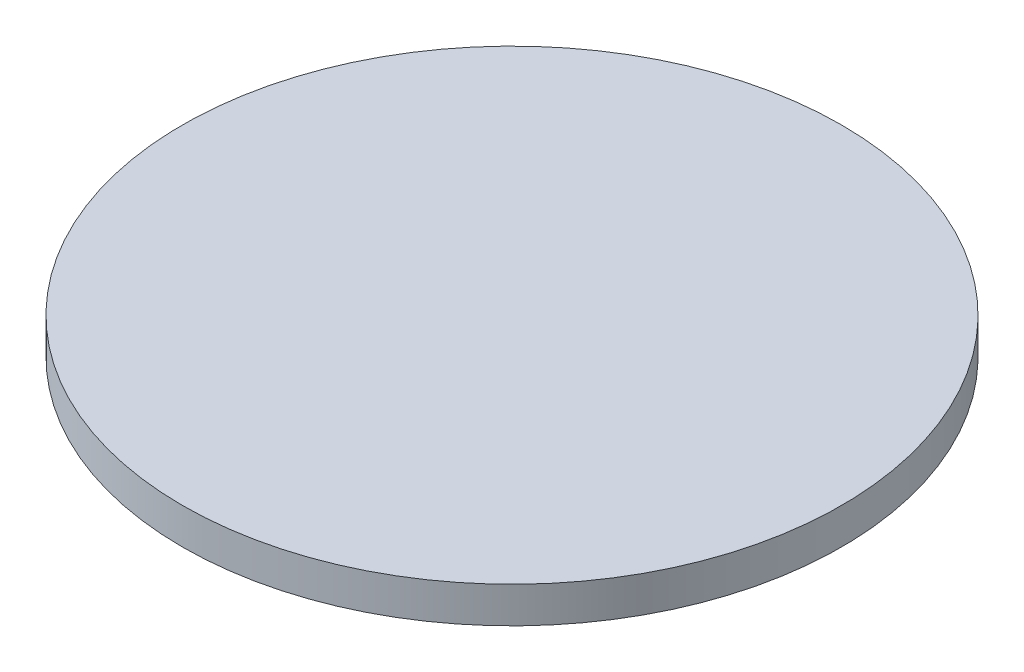
from build123d import *

# Parameters (mm, degrees)
ESQUISSE2_R        = 64
BOSS_EXTRU_1_DEPTH = 7


with BuildPart() as part:
    # Esquisse2 → Boss.-Extru.1 (new body)
    with BuildSketch(Plane(origin=(0, 0, 0), x_dir=(1, 0, 0), z_dir=(0, 1, 0))):
        with Locations(Location((0, 0, 0), (0, 0, 270))):
            Circle(ESQUISSE2_R)
    extrude(amount=BOSS_EXTRU_1_DEPTH)


solid = part.part
